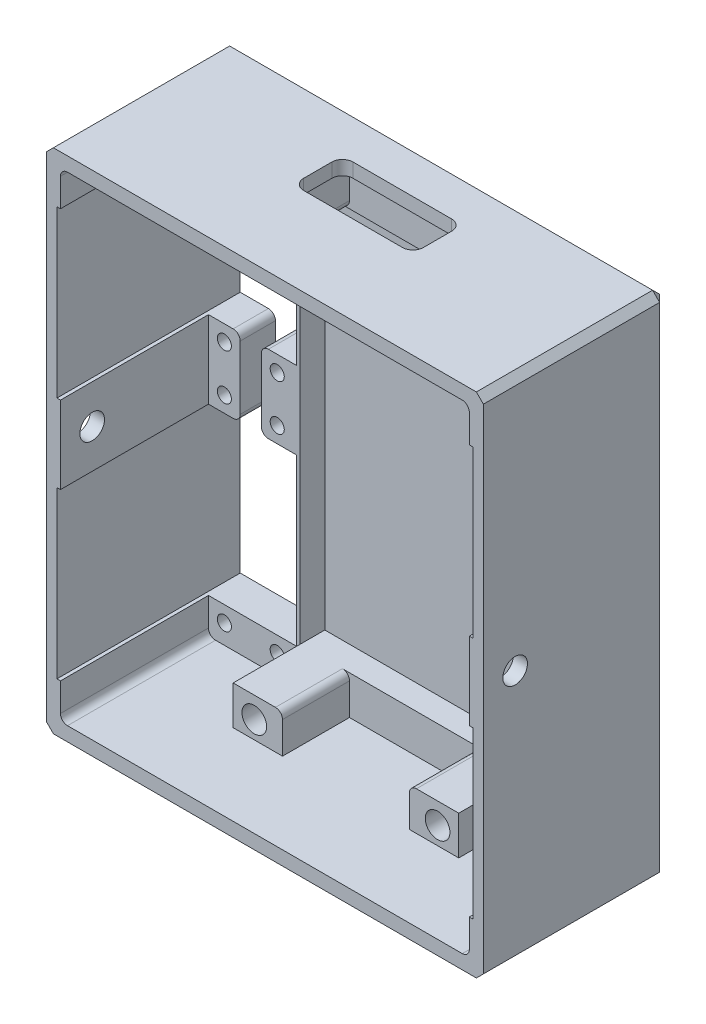
from build123d import *

# Parameters (mm, degrees)
SKETCH1_W                      = 62
SKETCH1_H                      = 26
BOSS_EXTRUDE1_DEPTH            = 2
BOSS_EXTRUDE2_DEPTH            = 68
SKETCH3_W                      = 62
SKETCH3_H                      = 26
BOSS_EXTRUDE3_DEPTH            = 2
SKETCH4_W                      = 5
SKETCH4_H                      = 58
CUT_EXTRUDE1_DEPTH             = 12.5
SKETCH5_W                      = 26
SKETCH5_H                      = 58
CUT_EXTRUDE2_DEPTH             = 0.5
SKETCH6_W                      = 58
SKETCH6_H                      = 5
CUT_EXTRUDE3_DEPTH             = 12.5
SKETCH7_W                      = 26
SKETCH7_H                      = 58
CUT_EXTRUDE4_DEPTH             = 0.5
SKETCH8_W                      = 5
SKETCH8_H                      = 11
BOSS_EXTRUDE4_DEPTH            = 5
SKETCH9_W                      = 26
SKETCH9_H                      = 11
BOSS_EXTRUDE5_DEPTH            = 5
SKETCH10_W                     = 5
SKETCH10_H                     = 11
BOSS_EXTRUDE6_DEPTH            = 5
SKETCH11_W                     = 26
SKETCH11_H                     = 11
BOSS_EXTRUDE7_DEPTH            = 5
SKETCH12_W                     = 7
SKETCH12_H                     = 9.5
BOSS_EXTRUDE8_DEPTH            = 5.5
SKETCH13_W                     = 7
SKETCH13_H                     = 9.5
BOSS_EXTRUDE9_DEPTH            = 5.5
SKETCH14_W                     = 32
SKETCH14_H                     = 57
CUT_EXTRUDE5_DEPTH             = 3.5
SKETCH15_W                     = 7
SKETCH15_H                     = 9.5
BOSS_EXTRUDE10_DEPTH           = 5.5
SKETCH16_W                     = 7
SKETCH16_H                     = 9.5
BOSS_EXTRUDE11_DEPTH           = 5.5
CUT_EXTRUDE6_REACH             = 58.476
SKETCH17_W                     = 4.5
SKETCH17_H                     = 21
CUT_EXTRUDE7_REACH             = 58.476
SKETCH18_W                     = 4.5
SKETCH18_H                     = 21
CUT_EXTRUDE8_REACH             = 83.555
SKETCH19_W                     = 17
SKETCH19_H                     = 7
F_2_0_2_DIAMETER_HOLE1_D       = 2
F_2_0_2_DIAMETER_HOLE1_DEPTH   = 26
F_3_5_3_5_DIAMETER_HOLE1_D     = 3.5
F_3_5_3_5_DIAMETER_HOLE1_DEPTH = 26
F_3_5_3_5_DIAMETER_HOLE2_D     = 3.5
F_3_5_3_5_DIAMETER_HOLE2_DEPTH = 2
F_3_5_3_5_DIAMETER_HOLE3_D     = 3.5
F_3_5_3_5_DIAMETER_HOLE3_DEPTH = 62
CHAMFER1_SIZE                  = 1.583333333
CHAMFER1_SIZE2                 = 1.696428571
CHAMFER2_SIZE                  = 1
FILLET1_R                      = 1
FILLET2_R                      = 1.5


with BuildPart() as part:
    # Sketch1 → Boss-Extrude1 (new body)
    with BuildSketch(Plane(origin=(0, -34, 0), x_dir=(1, 0, 0), z_dir=(0, 1, 0))):
        with Locations((0, -9.5)):
            Rectangle(SKETCH1_W, SKETCH1_H)
    extrude(amount=-BOSS_EXTRUDE1_DEPTH)

    # Sketch2 → Boss-Extrude2 (add)
    with BuildSketch(Plane(origin=(0, -34, 0), x_dir=(-1, 0, 0), z_dir=(0, 1, 0))):
        Polygon((-29, 22.5), (-29, 1.5), (29, 1.5), (29, 22.5), (31, 22.5), (31, -3.5), (-31, -3.5), (-31, 22.5), align=None)
    extrude(amount=BOSS_EXTRUDE2_DEPTH)

    # Sketch3 → Boss-Extrude3 (add)
    with BuildSketch(Plane(origin=(0, 34, 0), x_dir=(-1, 0, 0), z_dir=(0, 1, 0))):
        with Locations((0, 9.5)):
            Rectangle(SKETCH3_W, SKETCH3_H)
    extrude(amount=BOSS_EXTRUDE3_DEPTH)

    # Sketch4 → Cut-Extrude1 (cut)
    with BuildSketch(Plane(origin=(29, 0, 0), x_dir=(0, 0, -1), z_dir=(1, 0, 0))):
        with Locations((1, 0)):
            Rectangle(SKETCH4_W, SKETCH4_H)
    extrude(amount=-CUT_EXTRUDE1_DEPTH, mode=Mode.SUBTRACT)

    # Sketch5 → Cut-Extrude2 (cut)
    with BuildSketch(Plane.ZY.offset(-29)):
        with Locations((9.5, 0)):
            Rectangle(SKETCH5_W, SKETCH5_H)
    extrude(amount=-CUT_EXTRUDE2_DEPTH, mode=Mode.SUBTRACT)

    # Sketch6 → Cut-Extrude3 (cut)
    with BuildSketch(Plane(origin=(-29, 0, 0), x_dir=(0, -1, 0), z_dir=(-1, 0, 0))):
        with Locations((0, -1)):
            Rectangle(SKETCH6_W, SKETCH6_H)
    extrude(amount=-CUT_EXTRUDE3_DEPTH, mode=Mode.SUBTRACT)

    # Sketch7 → Cut-Extrude4 (cut)
    with BuildSketch(Plane(origin=(-29, 0, 0), x_dir=(0, 0, -1), z_dir=(1, 0, 0))):
        with Locations((-9.5, 0)):
            Rectangle(SKETCH7_W, SKETCH7_H)
    extrude(amount=-CUT_EXTRUDE4_DEPTH, mode=Mode.SUBTRACT)

    # Sketch8 → Boss-Extrude4 (add)
    with BuildSketch(Plane.ZY.offset(16.5)):
        with Locations((-1, 0)):
            Rectangle(SKETCH8_W, SKETCH8_H)
    extrude(amount=BOSS_EXTRUDE4_DEPTH)

    # Sketch9 → Boss-Extrude5 (add)
    with BuildSketch(Plane.ZY.offset(-29.5)):
        with Locations((9.5, 0)):
            Rectangle(SKETCH9_W, SKETCH9_H)
    extrude(amount=BOSS_EXTRUDE5_DEPTH)

    # Sketch10 → Boss-Extrude6 (add)
    with BuildSketch(Plane(origin=(16.5, 0, 0), x_dir=(0, 0, -1), z_dir=(1, 0, 0))):
        with Locations((1, 0)):
            Rectangle(SKETCH10_W, SKETCH10_H)
    extrude(amount=BOSS_EXTRUDE6_DEPTH)

    # Sketch11 → Boss-Extrude7 (add)
    with BuildSketch(Plane(origin=(-29.5, 0, 0), x_dir=(0, 0, -1), z_dir=(1, 0, 0))):
        with Locations((-9.5, 0)):
            Rectangle(SKETCH11_W, SKETCH11_H)
    extrude(amount=BOSS_EXTRUDE7_DEPTH)

    # Sketch12 → Boss-Extrude8 (add)
    with BuildSketch(Plane.XZ.offset(-34)):
        with Locations((-12.5, 6.25)):
            Rectangle(SKETCH12_W, SKETCH12_H)
    extrude(amount=BOSS_EXTRUDE8_DEPTH)

    # Sketch13 → Boss-Extrude9 (add)
    with BuildSketch(Plane(origin=(0, -34, 0), x_dir=(-1, 0, 0), z_dir=(0, 1, 0))):
        with Locations((-12.5, 6.25)):
            Rectangle(SKETCH13_W, SKETCH13_H)
    extrude(amount=BOSS_EXTRUDE9_DEPTH)

    # Sketch14 → Cut-Extrude5 (cut)
    with BuildSketch(Plane.XY.offset(1.5)):
        Rectangle(SKETCH14_W, SKETCH14_H)
    extrude(amount=-CUT_EXTRUDE5_DEPTH, mode=Mode.SUBTRACT)

    # Sketch15 → Boss-Extrude10 (add)
    with BuildSketch(Plane(origin=(0, -34, 0), x_dir=(-1, 0, 0), z_dir=(0, 1, 0))):
        with Locations((12.5, 6.25)):
            Rectangle(SKETCH15_W, SKETCH15_H)
    extrude(amount=BOSS_EXTRUDE10_DEPTH)

    # Sketch16 → Boss-Extrude11 (add)
    with BuildSketch(Plane.XZ.offset(-34)):
        with Locations((12.5, 6.25)):
            Rectangle(SKETCH16_W, SKETCH16_H)
    extrude(amount=BOSS_EXTRUDE11_DEPTH)

    # Sketch17 → Cut-Extrude6 (cut, up to next)
    with BuildSketch(Plane(origin=(0, 5.5, 0), x_dir=(-1, 0, 0), z_dir=(0, 1, 0)), mode=Mode.PRIVATE) as cut_extrude6_sk1:
        with Locations((-26.75, 12)):
            Rectangle(SKETCH17_W, SKETCH17_H)
    cut_extrude6_tool1 = extrude(cut_extrude6_sk1.sketch, amount=-CUT_EXTRUDE6_REACH, mode=Mode.PRIVATE) & part.part
    add(cut_extrude6_tool1.solids().sort_by_distance((26.75, 5.5, 12))[0], mode=Mode.SUBTRACT)

    # Sketch18 → Cut-Extrude7 (cut, up to next)
    with BuildSketch(Plane.XZ.offset(5.5), mode=Mode.PRIVATE) as cut_extrude7_sk1:
        with Locations((-26.75, 12)):
            Rectangle(SKETCH18_W, SKETCH18_H)
    cut_extrude7_tool1 = extrude(cut_extrude7_sk1.sketch, amount=-CUT_EXTRUDE7_REACH, mode=Mode.PRIVATE) & part.part
    add(cut_extrude7_tool1.solids().sort_by_distance((-26.75, -5.5, 12))[0], mode=Mode.SUBTRACT)

    # Sketch19 → Cut-Extrude8 (cut, up to next)
    with BuildSketch(Plane(origin=(0, 36, 0), x_dir=(-1, 0, 0), z_dir=(0, 1, 0)), mode=Mode.PRIVATE) as cut_extrude8_sk1:
        with Locations((0, 6.5)):
            Rectangle(SKETCH19_W, SKETCH19_H)
    cut_extrude8_tool1 = extrude(cut_extrude8_sk1.sketch, amount=-CUT_EXTRUDE8_REACH, mode=Mode.PRIVATE) & part.part
    add(cut_extrude8_tool1.solids().sort_by_distance((0, 36, 6.5))[0], mode=Mode.SUBTRACT)

    # Ø2.0 (2) Diameter Hole1
    with Locations(Plane(origin=(0, 0, -3.5), x_dir=(-1, 0, 0), z_dir=(0, 0, -1))):
        with Locations((-19.25, 3.25), (-19.25, -3.25), (19.25, 3.25), (19.25, -3.25), (-19.25, 31.25), (-26.75, 31.25), (-26.75, 3.25), (-26.75, -3.25), (19.25, -31.25), (-26.75, -31.25), (-19.25, -31.25), (26.75, -31.25), (26.75, -3.25), (26.75, 3.25), (26.75, 31.25), (19.25, 31.25)):
            Hole(F_2_0_2_DIAMETER_HOLE1_D / 2, depth=F_2_0_2_DIAMETER_HOLE1_DEPTH)

    # Ø3.5 (3.5) Diameter Hole1
    with Locations(Plane(origin=(0, 0, -3.5), x_dir=(-1, 0, 0), z_dir=(0, 0, -1))):
        with Locations((-13, 31.5), (13, 31.5), (-13, -31.5), (13, -31.5)):
            Hole(F_3_5_3_5_DIAMETER_HOLE1_D / 2, depth=F_3_5_3_5_DIAMETER_HOLE1_DEPTH)

    # Ø3.5 (3.5) Diameter Hole2
    with Locations(Plane(origin=(-29, 0, 0), x_dir=(0, 0, -1), z_dir=(1, 0, 0))):
        with Locations((-18, 0)):
            Hole(F_3_5_3_5_DIAMETER_HOLE2_D / 2, depth=F_3_5_3_5_DIAMETER_HOLE2_DEPTH)

    # Ø3.5 (3.5) Diameter Hole3
    with Locations(Plane(origin=(31, 0, 0), x_dir=(0, 0, -1), z_dir=(1, 0, 0))):
        with Locations((-18, 0)):
            Hole(F_3_5_3_5_DIAMETER_HOLE3_D / 2, depth=F_3_5_3_5_DIAMETER_HOLE3_DEPTH)

    # Chamfer1
    chamfer1_edges = [part.edges().sort_by_distance(p)[0] for p in [
        (-14.75, -31.5, -3.5),
        (11.25, -31.5, -3.5),
        (-14.75, 31.5, -3.5),
        (11.25, 31.5, -3.5),
    ]]
    chamfer1_side = [part.faces().sort_by_distance(p)[0] for p in [
        (0, 0, -3.5),
    ]]
    chamfer(chamfer1_edges, length=CHAMFER1_SIZE, length2=CHAMFER1_SIZE2, reference=chamfer1_side[0])

    # Chamfer2
    chamfer2_edges = [part.edges().sort_by_distance(p)[0] for p in [
        (31, -36, 9.5),
        (0, -36, -3.5),
        (-31, 36, 9.5),
        (31, 36, 9.5),
        (0, 36, -3.5),
        (-31, -36, 9.5),
        (-31, 0, -3.5),
        (31, 0, -3.5),
    ]]
    chamfer(chamfer2_edges, length=CHAMFER2_SIZE)

    # Fillet1
    fillet1_edges = [part.edges().sort_by_distance(p)[0] for p in [
        (-21.5, 5.5, -1),
        (-21.5, -5.5, -1),
        (24.5, -5.5, -1),
        (21.5, 5.5, -1),
        (21.5, -5.5, -1),
        (-24.5, 5.5, -1),
        (-29, -34, 12),
        (-9, 28.5, 6.25),
        (29, -34, 12),
        (9, -28.5, 6.25),
        (-29, 34, 12),
        (29, 34, 12),
        (-9, -28.5, 6.25),
        (9, 28.5, 6.25),
        (24.5, 5.5, -1),
        (-24.5, -5.5, -1),
    ]]
    fillet(fillet1_edges, radius=FILLET1_R)

    # Fillet2
    fillet2_edges = [part.edges().sort_by_distance(p)[0] for p in [
        (8.5, 35, 3),
        (8.5, 35, 10),
        (-8.5, 35, 10),
        (-8.5, 35, 3),
    ]]
    fillet(fillet2_edges, radius=FILLET2_R)


solid = part.part
